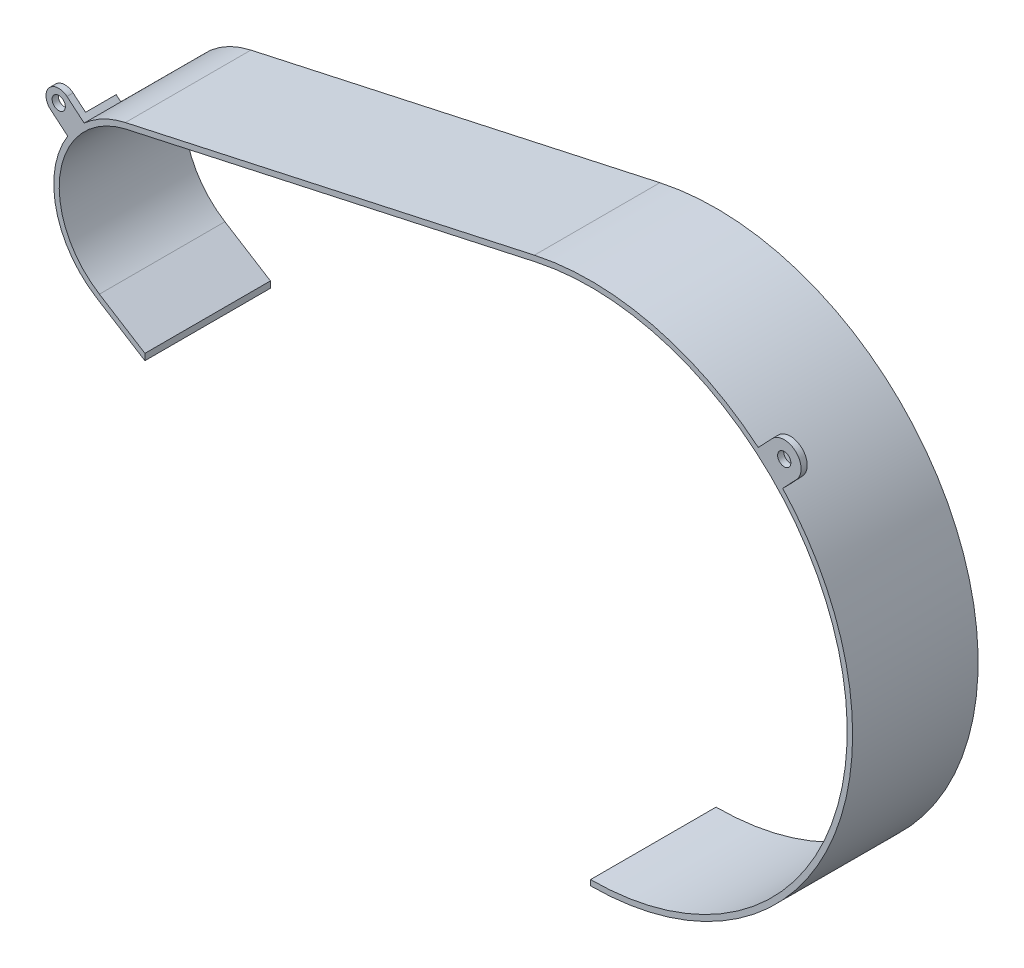
from build123d import *

# Parameters (mm, degrees)
BOSS_EXTRUDE2_DEPTH = 61.5
SKETCH2_W           = 218.385572997
SKETCH2_H           = 124.365016171
CUT_EXTRUDE1_DEPTH  = 386.947788646
BOSS_EXTRUDE3_START = -3
SKETCH3_R           = 3.25
BOSS_EXTRUDE3_DEPTH = 3
BOSS_EXTRUDE4_DEPTH = 15
BOSS_EXTRUDE5_START = -3
SKETCH6_R           = 3.25
BOSS_EXTRUDE5_DEPTH = 3


with BuildPart() as part:
    # Sketch1 → Boss-Extrude2 (new body)
    with BuildSketch(Plane.XY):
        with BuildLine():
            Line((190.193154767, 156.272365302), (-10.255131833, 112.342439715))
            ThreePointArc((-10.255131833, 112.342439715), (-44.696152673, 76.357425619), (-24.400621086, 30.869003427))
            Line((-24.400621086, 30.869003427), (149.508649244, -78.057208553))
            ThreePointArc((149.508649244, -78.057208553), (344.246573265, 8.82884943), (190.193154767, 156.272365302))
        make_face()
        with BuildLine():
            Line((-22.988653431, 33.123320916), (150.9206169, -75.802891064))
            ThreePointArc((150.9206169, -75.802891064), (341.625780844, 9.283873702), (190.762601119, 153.67403298))
            Line((190.762601119, 153.67403298), (-9.685685481, 109.744107393))
            ThreePointArc((-9.685685481, 109.744107393), (-42.075360252, 75.902401347), (-22.988653431, 33.123320916))
        make_face(mode=Mode.SUBTRACT)
    extrude(amount=BOSS_EXTRUDE2_DEPTH)

    # Sketch2 → Cut-Extrude1 (cut, through all)
    with BuildSketch(Plane.XY.offset(61.5)):
        with Locations((108.498359204, -35.464700503)):
            Rectangle(SKETCH2_W, SKETCH2_H)
    extrude(amount=-CUT_EXTRUDE1_DEPTH, mode=Mode.SUBTRACT)

    # Sketch3 → Boss-Extrude3 (add)
    with BuildSketch(Plane.XY.offset(61.5).offset(BOSS_EXTRUDE3_START)):
        with BuildLine():
            Line((-46.947493717, 99.519046948), (-38.537753643, 92.432744876))
            ThreePointArc((-38.537753643, 92.432744876), (-34.846524473, 97.495400572), (-30.483120585, 101.991661462))
            Line((-30.483120585, 101.991661462), (-38.892860659, 109.077963534))
            ThreePointArc((-38.892860659, 109.077963534), (-47.699635481, 108.32582177), (-46.947493717, 99.519046948))
        make_face()
        with Locations((-42.920177188, 104.298505241)):
            Circle(SKETCH3_R, mode=Mode.SUBTRACT)
    extrude(amount=BOSS_EXTRUDE3_DEPTH)

    # Sketch5 → Boss-Extrude4 (add)
    with BuildSketch(Plane(origin=(0, 0, 58.5), x_dir=(-1, 0, 0), z_dir=(0, 0, -1))):
        Polygon((32.777260566, 103.924773396), (40.831893624, 94.36585681), (38.537753643, 92.432744876), (30.483120585, 101.991661462), align=None)
    extrude(amount=BOSS_EXTRUDE4_DEPTH)

    # Sketch6 → Boss-Extrude5 (add)
    with BuildSketch(Plane.XY.offset(61.5).offset(BOSS_EXTRUDE5_START)):
        with BuildLine():
            Line((306.628435129, 136.596320054), (299.898517045, 129.498130867))
            ThreePointArc((299.898517045, 129.498130867), (306.06786247, 124.01433514), (311.872256717, 118.145617565))
            Line((311.872256717, 118.145617565), (318.602174802, 125.243806752))
            ThreePointArc((318.602174802, 125.243806752), (318.291561616, 136.906933239), (306.628435129, 136.596320054))
        make_face()
        with Locations((312.615304965, 130.920063403)):
            Circle(SKETCH6_R, mode=Mode.SUBTRACT)
    extrude(amount=BOSS_EXTRUDE5_DEPTH)


solid = part.part
